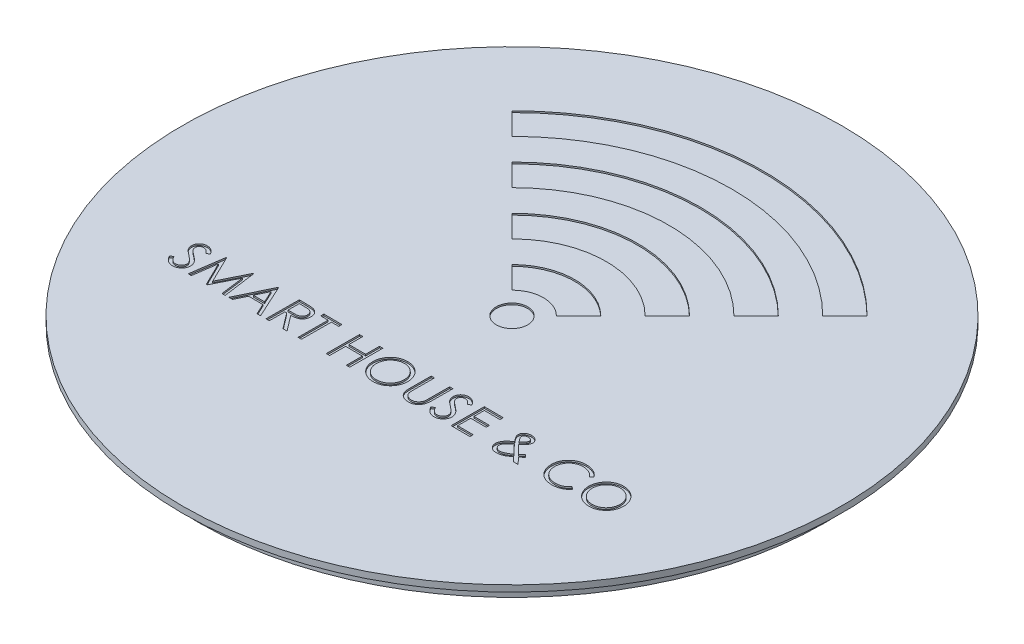
from build123d import *

# Parameters (mm, degrees)
CROQUIS1_R              = 105
SALIENTE_EXTRUIR1_DEPTH = 2
CROQUIS7_R              = 100
SALIENTE_EXTRUIR4_DEPTH = 5
CROQUIS8_R              = 5
CORTAR_EXTRUIR6_DEPTH   = 0.5


with BuildPart() as part:
    # Croquis1 → Saliente-Extruir1 (new body)
    with BuildSketch(Plane(origin=(0, 0, 0), x_dir=(1, 0, 0), z_dir=(0, 1, 0))):
        with Locations(Location((0, 0, 0), (0, 0, 270))):
            Circle(CROQUIS1_R)
    extrude(amount=SALIENTE_EXTRUIR1_DEPTH)

    # Croquis7 → Saliente-Extruir4 (add)
    with BuildSketch(Plane.XZ):
        with Locations(Location((0, 0, 0), (0, 0, 90))):
            Circle(CROQUIS7_R)
    extrude(amount=SALIENTE_EXTRUIR4_DEPTH)

    # Croquis8 → Cortar-Extruir6 (cut)
    # profile 1 of 18: a face of its own
    with BuildSketch(Plane(origin=(0, 2, 0), x_dir=(1, 0, 0), z_dir=(0, 1, 0))):
        with Locations(Location((0, 0, 0), (0, 0, 270))):
            Circle(CROQUIS8_R)
    # profile 2 of 18: a face of its own
    with BuildSketch(Plane(origin=(0, 2, 0), x_dir=(1, 0, 0), z_dir=(0, 1, 0))):
        with BuildLine():
            Line((7.071067812, 7.071067812), (14.142135624, 14.142135624))
            ThreePointArc((14.142135624, 14.142135624), (0, 20), (-14.142135624, 14.142135624))
            Line((-14.142135624, 14.142135624), (-7.071067812, 7.071067812))
            ThreePointArc((-7.071067812, 7.071067812), (0, 10), (7.071067812, 7.071067812))
        make_face()
    # profile 3 of 18: a face of its own
    with BuildSketch(Plane(origin=(0, 2, 0), x_dir=(1, 0, 0), z_dir=(0, 1, 0))):
        with BuildLine():
            Line((-21.213203436, 21.213203436), (-28.284271247, 28.284271247))
            ThreePointArc((-28.284271247, 28.284271247), (0, 40), (28.284271247, 28.284271247))
            Line((28.284271247, 28.284271247), (21.213203436, 21.213203436))
            ThreePointArc((21.213203436, 21.213203436), (0, 30), (-21.213203436, 21.213203436))
        make_face()
    # profile 4 of 18: a face of its own
    with BuildSketch(Plane(origin=(0, 2, 0), x_dir=(1, 0, 0), z_dir=(0, 1, 0))):
        with BuildLine():
            Line((-35.355339059, 35.355339059), (-42.426406871, 42.426406871))
            ThreePointArc((-42.426406871, 42.426406871), (0, 60), (42.426406871, 42.426406871))
            Line((42.426406871, 42.426406871), (35.355339059, 35.355339059))
            ThreePointArc((35.355339059, 35.355339059), (0, 50), (-35.355339059, 35.355339059))
        make_face()
    # profile 5 of 18: a face of its own
    with BuildSketch(Plane(origin=(0, 2, 0), x_dir=(1, 0, 0), z_dir=(0, 1, 0))):
        with BuildLine():
            Line((-49.497474683, 49.497474683), (-56.568542495, 56.568542495))
            ThreePointArc((-56.568542495, 56.568542495), (0, 80), (56.568542495, 56.568542495))
            Line((56.568542495, 56.568542495), (49.497474683, 49.497474683))
            ThreePointArc((49.497474683, 49.497474683), (0, 70), (-49.497474683, 49.497474683))
        make_face()
    # profile 6 of 18: a face of its own
    with BuildSketch(Plane(origin=(0, 2, 0), x_dir=(1, 0, 0), z_dir=(0, 1, 0))):
        with BuildLine():
            add(Edge.make_bspline(
                [(64.763555021, -29.24070179), (64.958889562, -29.246025488), (65.34268299, -29.256485494), (65.905343311, -29.338125575), (66.444213855, -29.463457398), (66.958018963, -29.643451971), (67.447673108, -29.87073064), (67.912854041, -30.147767488), (68.351658709, -30.477151302), (68.761360882, -30.851912606), (69.134268077, -31.261985091), (69.461159464, -31.699181452), (69.738572071, -32.158854637), (69.9646275, -32.641820202), (70.136754058, -33.148469147), (70.258964274, -33.676810359), (70.33656483, -34.228295648), (70.342601339, -34.604187365), (70.345669738, -34.795255743)],
                knots=[0, 0, 0, 0, 1.066480477, 2.095421517, 3.099031254, 4.08412256, 5.063237125, 6.042922112, 7.035658862, 8.054735947, 9.071214844, 10.058549417, 11.031612258, 11.998600907, 12.965319905, 13.948375013, 14.957144731, 16, 16, 16, 16], degree=3))
            add(Edge.make_bspline(
                [(70.345669738, -34.795255743), (70.340238254, -34.984220598), (70.329531059, -35.356730869), (70.248734215, -35.904256422), (70.120123795, -36.429129101), (69.940412356, -36.932143756), (69.710794761, -37.412280517), (69.430915544, -37.871089015), (69.100903269, -38.307381443), (68.723125169, -38.713977567), (68.313707327, -39.08826559), (67.875297272, -39.414111734), (67.41469944, -39.688974396), (66.933124801, -39.915899899), (66.428304047, -40.089979232), (65.901934629, -40.212734136), (65.354330055, -40.286399959), (64.982149415, -40.294710151), (64.793235844, -40.298928285)],
                knots=[0, 0, 0, 0, 1.041586142, 2.053299996, 3.044639854, 4.017045683, 4.993028163, 5.974022359, 6.975419105, 8.003943238, 9.030080649, 10.029922165, 11.010227414, 11.982875217, 12.960047006, 13.948649357, 14.958763746, 16, 16, 16, 16], degree=3))
            add(Edge.make_bspline(
                [(64.793235844, -40.298928285), (64.601443609, -40.293550789), (64.224703502, -40.2829877), (63.671543181, -40.202035232), (63.141860576, -40.073063417), (62.634703154, -39.894149134), (62.150297262, -39.666569559), (61.689928461, -39.386218182), (61.252359839, -39.056877126), (60.844118748, -38.680660533), (60.471242192, -38.271352388), (60.145239797, -37.835381231), (59.869960751, -37.378628701), (59.642887221, -36.90227941), (59.471306449, -36.402445291), (59.348873047, -35.882672801), (59.271272968, -35.342465094), (59.265119485, -34.975019327), (59.262002537, -34.788895566)],
                knots=[0, 0, 0, 0, 1.058465599, 2.079158432, 3.079305173, 4.06394649, 5.042991754, 6.028536918, 7.034290932, 8.06144979, 9.088860518, 10.086813485, 11.061644533, 12.028440788, 12.994488971, 13.97292776, 14.973219061, 16, 16, 16, 16], degree=3))
            add(Edge.make_bspline(
                [(59.262002537, -34.788895566), (59.264337582, -34.663704374), (59.26897902, -34.414858136), (59.309601285, -34.045429557), (59.368422259, -33.682979989), (59.448141929, -33.326782206), (59.555856993, -32.979203377), (59.682032042, -32.637160477), (59.833745847, -32.303209113), (60.006846489, -31.978385662), (60.199244888, -31.665316563), (60.408629624, -31.367812374), (60.637507384, -31.089347677), (60.879428872, -30.826360106), (61.141084236, -30.583825494), (61.415774897, -30.356040851), (61.709971785, -30.148353622), (62.017797482, -29.958229472), (62.338185736, -29.788832281), (62.665921055, -29.640599237), (63.000024425, -29.514706277), (63.340045264, -29.412787758), (63.687083879, -29.333859057), (64.040601043, -29.279307876), (64.400407104, -29.246780858), (64.641938344, -29.242737643), (64.763555021, -29.24070179)],
                knots=[0, 0, 0, 0, 1.036737542, 2.060753897, 3.075103556, 4.077695985, 5.081364496, 6.087164683, 7.095839733, 8.117175411, 9.13422416, 10.137978025, 11.12813741, 12.118141044, 13.095586573, 14.081219155, 15.07203589, 16.076045774, 17.076379801, 18.071975159, 19.053793285, 20.031659432, 21.010121144, 21.999501524, 22.992701819, 24, 24, 24, 24], degree=3))
        make_face()
        with BuildLine():
            add(Edge.make_bspline(
                [(64.810196314, -30.273170406), (64.713336953, -30.274871974), (64.520696728, -30.278256164), (64.233556725, -30.303269385), (63.951084524, -30.350645698), (63.672002743, -30.416500576), (63.396972425, -30.502012504), (63.124028201, -30.60287272), (62.856526227, -30.727528546), (62.593770765, -30.868122521), (62.339152858, -31.024687905), (62.098706052, -31.195806363), (61.871679878, -31.379448757), (61.659318357, -31.577207837), (61.460809788, -31.788109618), (61.276957359, -32.012893918), (61.107622524, -32.250076876), (60.952726876, -32.499833328), (60.816009121, -32.760419129), (60.693586565, -33.027950332), (60.592971728, -33.304238905), (60.506566961, -33.587575614), (60.441738296, -33.879011266), (60.395483769, -34.177910327), (60.364310723, -34.483662987), (60.360168247, -34.690589156), (60.358072917, -34.795255743)],
                knots=[0, 0, 0, 0, 0.988012236, 1.965023296, 2.93680795, 3.907228056, 4.887716744, 5.873174782, 6.873080972, 7.895445908, 8.911744251, 9.919854061, 10.903834491, 11.888263715, 12.877616234, 13.856009207, 14.848193998, 15.848437938, 16.851302053, 17.848215479, 18.847185769, 19.848364419, 20.867955437, 21.889557661, 22.932504293, 24, 24, 24, 24], degree=3))
            add(Edge.make_bspline(
                [(60.358072917, -34.795255743), (60.360531339, -34.948816458), (60.365365861, -35.250795852), (60.427427967, -35.694457643), (60.526040878, -36.120082559), (60.667241812, -36.527705641), (60.847695565, -36.917387207), (61.070469309, -37.288163829), (61.331794033, -37.642340889), (61.634617499, -37.970720611), (61.960765638, -38.275885624), (62.313304751, -38.538072956), (62.678611659, -38.766771581), (63.064836332, -38.947756891), (63.465280799, -39.093864974), (63.882954522, -39.197944578), (64.317910158, -39.259985788), (64.613538209, -39.269905921), (64.763555021, -39.274939904)],
                knots=[0, 0, 0, 0, 1.053017702, 2.070774718, 3.067059598, 4.047018636, 5.025500756, 6.00851463, 7.010401421, 8.040217454, 9.069736588, 10.070637084, 11.050392128, 12.02215799, 12.991634333, 13.971353373, 14.970560815, 16, 16, 16, 16], degree=3))
            add(Edge.make_bspline(
                [(64.763555021, -39.274939904), (64.864660891, -39.273307021), (65.065075635, -39.270070278), (65.363270893, -39.244239929), (65.655789969, -39.199916835), (65.942769129, -39.136450039), (66.223364039, -39.052547626), (66.499435183, -38.953722169), (66.769236406, -38.834469693), (67.031702097, -38.696580601), (67.284500938, -38.542911194), (67.52453507, -38.37508244), (67.751522552, -38.194209791), (67.961681872, -37.996973681), (68.160905393, -37.788866772), (68.342862338, -37.565672104), (68.51107081, -37.32893044), (68.665559019, -37.080091639), (68.802310395, -36.819503182), (68.924486235, -36.55190305), (69.025986313, -36.276082254), (69.108558548, -35.992552313), (69.174912396, -35.702438617), (69.220400588, -35.404783854), (69.251894332, -35.100503286), (69.256001824, -34.894979565), (69.258079594, -34.791015625)],
                knots=[0, 0, 0, 0, 1.027865415, 2.03746218, 3.040415186, 4.034059841, 5.023017468, 6.016246394, 7.013521287, 8.019455302, 9.028668486, 10.019321209, 10.995564338, 11.976765725, 12.947493611, 13.922678539, 14.901588535, 15.898552783, 16.898128616, 17.891773272, 18.887468046, 19.883318352, 20.892557113, 21.910809614, 22.943185431, 24, 24, 24, 24], degree=3))
            add(Edge.make_bspline(
                [(69.258079594, -34.791015625), (69.256420354, -34.687794567), (69.253130869, -34.483156143), (69.227794628, -34.179953538), (69.18275683, -33.884859916), (69.121638533, -33.597089135), (69.040865249, -33.31654157), (68.940880279, -33.043475099), (68.824589095, -32.777272431), (68.688205505, -32.520660655), (68.535881517, -32.274105658), (68.370829321, -32.036711299), (68.187506106, -31.815202219), (67.99229649, -31.603298382), (67.779655341, -31.406431432), (67.551604799, -31.221952485), (67.310770054, -31.047227272), (67.054437661, -30.890200901), (66.790721526, -30.745231481), (66.51963835, -30.621051944), (66.245185362, -30.514119236), (65.966189999, -30.426670999), (65.682729355, -30.359230408), (65.395242901, -30.310324), (65.104133207, -30.279660012), (64.908499547, -30.275340767), (64.810196314, -30.273170406)],
                knots=[0, 0, 0, 0, 1.053322565, 2.088239301, 3.102059752, 4.097867256, 5.088490546, 6.078641198, 7.063525053, 8.050703418, 9.041457957, 10.01985135, 10.998669923, 11.973335075, 12.958192526, 13.952745732, 14.965488279, 15.992155319, 17.018391661, 18.034850707, 19.032614895, 20.022555413, 21.01611451, 22.003740605, 22.996907018, 24, 24, 24, 24], degree=3))
        make_face(mode=Mode.SUBTRACT)
    # profile 7 of 18: a face of its own
    with BuildSketch(Plane(origin=(0, 2, 0), x_dir=(1, 0, 0), z_dir=(0, 1, 0))):
        with BuildLine():
            Line((57.599876469, -31.485844017), (56.764573317, -32.117621528))
            add(Edge.make_bspline(
                [(56.764573317, -32.117621528), (56.70766709, -32.043961168), (56.594761433, -31.897814223), (56.408538472, -31.695765102), (56.217808661, -31.502982354), (56.016649262, -31.325240406), (55.805760221, -31.161841158), (55.587726268, -31.010671759), (55.359852801, -30.874948443), (55.124505495, -30.752641276), (54.882986459, -30.640525959), (54.632408323, -30.549132464), (54.377197123, -30.468018474), (54.116566105, -30.398919833), (53.848391162, -30.349522332), (53.57547156, -30.310816369), (53.295873561, -30.286829445), (53.107518373, -30.283392377), (53.012069311, -30.281650641)],
                knots=[0, 0, 0, 0, 1.030072775, 2.043731383, 3.039569046, 4.031742415, 5.01302796, 5.991815002, 6.967313047, 7.947193968, 8.92754332, 9.912875421, 10.897710381, 11.892102416, 12.895655593, 13.914734875, 14.943291108, 16, 16, 16, 16], degree=3))
            add(Edge.make_bspline(
                [(53.012069311, -30.281650641), (52.908152379, -30.283388485), (52.701419985, -30.286845753), (52.394445038, -30.311224762), (52.094026112, -30.359887096), (51.798000685, -30.421807698), (51.508463758, -30.508250383), (51.222658986, -30.608630797), (50.945569813, -30.733336384), (50.674212166, -30.871803528), (50.415657831, -31.028985987), (50.167637775, -31.19586223), (49.936916038, -31.379072827), (49.719117402, -31.574153843), (49.518840495, -31.784626957), (49.330272715, -32.005670891), (49.159091748, -32.241597707), (49.002173699, -32.48920385), (48.862543605, -32.747041152), (48.741705362, -33.0137128), (48.636044745, -33.286877072), (48.555654395, -33.570814928), (48.485211115, -33.860826612), (48.440838364, -34.16104675), (48.409281561, -34.468100703), (48.405146206, -34.67574259), (48.403061565, -34.780415331)],
                knots=[0, 0, 0, 0, 1.04139569, 2.071753077, 3.082354545, 4.089376716, 5.100077429, 6.108070248, 7.122633903, 8.142497508, 9.159036466, 10.152925182, 11.136160435, 12.108909118, 13.080574533, 14.045351005, 15.018460509, 15.998835287, 16.981126483, 17.95402982, 18.931253536, 19.912778613, 20.909086413, 21.919687881, 22.951309988, 24, 24, 24, 24], degree=3))
            add(Edge.make_bspline(
                [(48.403061565, -34.780415331), (48.406426792, -34.93749611), (48.413045923, -35.246461383), (48.474247494, -35.700059049), (48.572962973, -36.135077265), (48.715251523, -36.55044891), (48.901493221, -36.944891687), (49.127591881, -37.319747357), (49.39353303, -37.675866771), (49.70044927, -38.00607613), (50.037119865, -38.308635643), (50.400875988, -38.571882542), (50.785681833, -38.796342315), (51.19188189, -38.982691904), (51.622210364, -39.12280914), (52.072209568, -39.228567969), (52.544705216, -39.289646618), (52.867029094, -39.299568637), (53.03114984, -39.304620726)],
                knots=[0, 0, 0, 0, 1.04114744, 2.047853384, 3.028841231, 3.995044826, 4.953031867, 5.915797611, 6.893298517, 7.894766775, 8.900337837, 9.89015014, 10.866650883, 11.85015373, 12.847436254, 13.862494403, 14.911625736, 16, 16, 16, 16], degree=3))
            add(Edge.make_bspline(
                [(53.03114984, -39.304620726), (53.211639969, -39.300881572), (53.567345608, -39.293512536), (54.089492905, -39.212938453), (54.589014276, -39.078565884), (55.067137926, -38.891902862), (55.521244457, -38.647217644), (55.953821353, -38.350884939), (56.364477468, -37.99919929), (56.611137338, -37.729331769), (56.737012553, -37.591613248)],
                knots=[0, 0, 0, 0, 1.025761438, 2.021546153, 2.99544534, 3.962646408, 4.933555875, 5.922308906, 6.939714775, 8, 8, 8, 8], degree=3))
            Line((56.737012553, -37.591613248), (57.56383547, -38.225510817))
            add(Edge.make_bspline(
                [(57.56383547, -38.225510817), (57.496892524, -38.306844998), (57.363223979, -38.469249287), (57.14737321, -38.698178086), (56.916816047, -38.909929172), (56.67685355, -39.110277277), (56.424571656, -39.297111613), (56.159003031, -39.469072802), (55.881187322, -39.625689618), (55.592298167, -39.767633855), (55.294353707, -39.895672833), (54.984820339, -40.002839747), (54.668379029, -40.097168602), (54.342136229, -40.169884699), (54.009356981, -40.231126672), (53.666431358, -40.269252588), (53.315697558, -40.297002731), (53.078555532, -40.298283134), (52.959067842, -40.298928285)],
                knots=[0, 0, 0, 0, 0.966184171, 1.929231373, 2.883422578, 3.83631357, 4.795797521, 5.761416048, 6.736799811, 7.719652295, 8.713052809, 9.709515828, 10.722916398, 11.740414375, 12.774281871, 13.825263903, 14.904225458, 16, 16, 16, 16], degree=3))
            add(Edge.make_bspline(
                [(52.959067842, -40.298928285), (52.84524955, -40.29720299), (52.620907973, -40.293802345), (52.289115348, -40.269734445), (51.966435346, -40.232057143), (51.65319155, -40.178642288), (51.348690433, -40.113374326), (51.053497411, -40.03281264), (50.767936982, -39.937057417), (50.490226635, -39.829625722), (50.223744186, -39.703328234), (49.965093096, -39.566089298), (49.715024529, -39.415205568), (49.476662161, -39.247478369), (49.245498387, -39.066084278), (49.025154879, -38.870188063), (48.812148998, -38.660580337), (48.679926909, -38.511112375), (48.612947382, -38.435396635)],
                knots=[0, 0, 0, 0, 1.117876981, 2.203391743, 3.265825228, 4.307674998, 5.323321263, 6.323551801, 7.311300932, 8.280610687, 9.246335005, 10.205852996, 11.155807992, 12.112837218, 13.066815803, 14.040415603, 15.007336543, 16, 16, 16, 16], degree=3))
            add(Edge.make_bspline(
                [(48.612947382, -38.435396635), (48.506409745, -38.304511846), (48.294860606, -38.044617174), (48.025792675, -37.621593262), (47.799043633, -37.179474745), (47.610332254, -36.719027698), (47.466092778, -36.237553247), (47.364990248, -35.735824508), (47.304461661, -35.214406376), (47.297701815, -34.860432926), (47.294270833, -34.680772569)],
                knots=[0, 0, 0, 0, 0.995083708, 1.975912988, 2.951231747, 3.923756722, 4.907833335, 5.912021988, 6.940240087, 8, 8, 8, 8], degree=3))
            add(Edge.make_bspline(
                [(47.294270833, -34.680772569), (47.299435234, -34.491769674), (47.3095996, -34.119781733), (47.393819965, -33.574744061), (47.521998738, -33.05157594), (47.703208426, -32.552331986), (47.932764951, -32.075036439), (48.218268209, -31.62462303), (48.549108758, -31.193977364), (48.930788813, -30.794570414), (49.345818941, -30.426990497), (49.794018366, -30.107590546), (50.266324177, -29.836118036), (50.765191463, -29.617886801), (51.288326519, -29.446603691), (51.836714616, -29.327465636), (52.410695764, -29.252298622), (52.801943186, -29.246022503), (53.001469017, -29.242821848)],
                knots=[0, 0, 0, 0, 1.030158166, 2.027516113, 3.000498436, 3.963539271, 4.918395332, 5.882846155, 6.866409552, 7.875020706, 8.890821121, 9.885345871, 10.870968157, 11.856228752, 12.849446023, 13.867677765, 14.912572087, 16, 16, 16, 16], degree=3))
            add(Edge.make_bspline(
                [(53.001469017, -29.242821848), (53.12307595, -29.244974107), (53.363118869, -29.249222504), (53.719208521, -29.279558538), (54.065504156, -29.329394232), (54.40410627, -29.39050167), (54.731648516, -29.477890535), (55.051764675, -29.577780732), (55.361876828, -29.700068748), (55.663004629, -29.83738499), (55.952834073, -29.991391635), (56.228460057, -30.162353841), (56.493268996, -30.343483984), (56.740337167, -30.544517387), (56.977809357, -30.756418943), (57.199049568, -30.985523434), (57.408772443, -31.227705667), (57.535940937, -31.399481562), (57.599876469, -31.485844017)],
                knots=[0, 0, 0, 0, 1.097419881, 2.16622412, 3.222395201, 4.254334303, 5.269082988, 6.279594037, 7.279178134, 8.275174951, 9.265212015, 10.238718646, 11.201131781, 12.158311203, 13.111146369, 14.071803988, 15.030575614, 16, 16, 16, 16], degree=3))
        make_face()
    # profile 8 of 18: a face of its own
    with BuildSketch(Plane(origin=(0, 2, 0), x_dir=(1, 0, 0), z_dir=(0, 1, 0))):
        with BuildLine():
            Line((40.541883681, -36.156333467), (41.252103365, -36.917434562))
            add(Edge.make_bspline(
                [(41.252103365, -36.917434562), (41.140053219, -37.015323624), (40.922649812, -37.205251227), (40.601505089, -37.475306803), (40.302026055, -37.729844071), (40.10347247, -37.886840127), (40.007628873, -37.962623531)],
                knots=[0, 0, 0, 0, 1.098479744, 2.1313068, 3.097965033, 4, 4, 4, 4], degree=3))
            add(Edge.make_bspline(
                [(40.007628873, -37.962623531), (40.074497787, -38.034253039), (40.220492357, -38.190641391), (40.464791826, -38.439753049), (40.742145255, -38.733972646), (40.944932453, -38.939010728), (41.052817842, -39.048093616)],
                knots=[0, 0, 0, 0, 0.780303742, 1.703633321, 2.77830349, 4, 4, 4, 4], degree=3))
            add(Edge.make_bspline(
                [(41.052817842, -39.048093616), (41.141062629, -39.136546449), (41.312655676, -39.308544042), (41.552510491, -39.568910762), (41.778923838, -39.812818008), (41.918324546, -39.976214415), (41.985643697, -40.055121528)],
                knots=[0, 0, 0, 0, 1.091843561, 2.123102899, 3.09361207, 4, 4, 4, 4], degree=3))
            Line((41.985643697, -40.055121528), (40.520683093, -40.048761351))
            Line((40.520683093, -40.048761351), (39.17444578, -38.630442041))
            add(Edge.make_bspline(
                [(39.17444578, -38.630442041), (39.063863725, -38.712918364), (38.85002153, -38.872410047), (38.534204416, -39.095361765), (38.234056542, -39.29438594), (37.953379267, -39.475378918), (37.688079336, -39.633497483), (37.438186328, -39.766135793), (37.206786538, -39.87981198), (36.921857036, -40.001992922), (36.567684788, -40.116178618), (36.13687548, -40.217418914), (35.69347181, -40.275144664), (35.394540134, -40.282500205), (35.243856838, -40.286207933)],
                knots=[0, 0, 0, 0, 1.140693549, 2.205858906, 3.19611503, 4.118473484, 4.967320685, 5.748983737, 6.457237516, 7.09870039, 8.310927132, 9.52855032, 10.754209696, 12, 12, 12, 12], degree=3))
            add(Edge.make_bspline(
                [(35.243856838, -40.286207933), (35.144819487, -40.283567503), (34.951105191, -40.278402897), (34.668858788, -40.243919491), (34.401091422, -40.189291346), (34.148976962, -40.111089978), (33.9114326, -40.010251651), (33.68845398, -39.890011641), (33.480522199, -39.746767736), (33.291812231, -39.58150963), (33.119309582, -39.402359988), (32.971514804, -39.208786466), (32.84380354, -39.00594459), (32.743596175, -38.790777153), (32.660107953, -38.566811598), (32.607593575, -38.330577743), (32.571208653, -38.084600237), (32.567907804, -37.916831051), (32.566222623, -37.831179888)],
                knots=[0, 0, 0, 0, 1.166436736, 2.281517716, 3.344293869, 4.38163215, 5.385016872, 6.379523137, 7.360843545, 8.352209587, 9.329567906, 10.285239896, 11.216120302, 12.146963491, 13.076465835, 14.025444037, 14.991930402, 16, 16, 16, 16], degree=3))
            add(Edge.make_bspline(
                [(32.566222623, -37.831179888), (32.573258167, -37.699165158), (32.587468974, -37.432514012), (32.689257861, -37.035007082), (32.847471244, -36.63901973), (33.029903704, -36.311289335), (33.216225137, -36.044904697), (33.391916563, -35.828169979), (33.599124304, -35.598773953), (33.83878101, -35.356098127), (34.109172282, -35.099525406), (34.416361981, -34.834509024), (34.750611715, -34.550542569), (34.988819986, -34.362701488), (35.112413194, -34.265241052)],
                knots=[0, 0, 0, 0, 1.046820167, 2.114429185, 3.236909509, 4.424213621, 5.080657719, 5.814514911, 6.63642802, 7.532553187, 8.520228328, 9.593154786, 10.751220008, 12, 12, 12, 12], degree=3))
            add(Edge.make_bspline(
                [(35.112413194, -34.265241052), (35.043476884, -34.181455444), (34.910583606, -34.019936151), (34.725622722, -33.782602152), (34.556692168, -33.565108454), (34.410701262, -33.36236851), (34.281023261, -33.178636575), (34.169831873, -33.01201778), (34.080997476, -32.860349113), (33.985409935, -32.68667534), (33.897734233, -32.479572664), (33.82026621, -32.238583025), (33.773071088, -32.002150116), (33.767026509, -31.846451818), (33.764055823, -31.769931891)],
                knots=[0, 0, 0, 0, 1.350487771, 2.603428373, 3.745283003, 4.778115756, 5.712784749, 6.54474205, 7.270388257, 7.90012321, 9.011273691, 10.062890135, 11.04798249, 12, 12, 12, 12], degree=3))
            add(Edge.make_bspline(
                [(33.764055823, -31.769931891), (33.766117931, -31.705496433), (33.770151526, -31.579457238), (33.801181747, -31.394686548), (33.849437098, -31.218150965), (33.917754152, -31.050610228), (34.003506343, -30.890686986), (34.109814634, -30.741396374), (34.234215166, -30.598531331), (34.329800469, -30.513823762), (34.378872863, -30.470335871)],
                knots=[0, 0, 0, 0, 1.039857389, 2.03401655, 3.016717178, 3.989230655, 4.949010733, 5.939825086, 6.942329906, 8, 8, 8, 8], degree=3))
            add(Edge.make_bspline(
                [(34.378872863, -30.470335871), (34.438737076, -30.422438891), (34.557897376, -30.327099486), (34.752000944, -30.207020762), (34.955544932, -30.104187908), (35.169301561, -30.018483235), (35.395843096, -29.956344389), (35.630788164, -29.908468241), (35.877216891, -29.883704543), (36.044484689, -29.880485832), (36.1300414, -29.878839476)],
                knots=[0, 0, 0, 0, 0.973492464, 1.937746257, 2.893558284, 3.869078126, 4.858347323, 5.874517614, 6.912825528, 8, 8, 8, 8], degree=3))
            add(Edge.make_bspline(
                [(36.1300414, -29.878839476), (36.237670541, -29.881960209), (36.449225281, -29.88809429), (36.758725877, -29.940628553), (37.053677633, -30.025005773), (37.329323277, -30.144310364), (37.584018831, -30.286438982), (37.808801997, -30.455213004), (38.002624401, -30.646692774), (38.157593201, -30.862395704), (38.284613942, -31.087678321), (38.371495925, -31.324824618), (38.427419162, -31.567320841), (38.4335871, -31.732177945), (38.436665331, -31.814453125)],
                knots=[0, 0, 0, 0, 1.156239637, 2.272692802, 3.36413441, 4.446364256, 5.494106609, 6.49226497, 7.459119393, 8.410238837, 9.338421569, 10.230173272, 11.116733159, 12, 12, 12, 12], degree=3))
            add(Edge.make_bspline(
                [(38.436665331, -31.814453125), (38.432112425, -31.904669016), (38.422725712, -32.090666826), (38.344461977, -32.369943439), (38.226285474, -32.657624139), (38.089184731, -32.89988062), (37.951261846, -33.101482668), (37.822016286, -33.265503677), (37.672345071, -33.440438255), (37.499436258, -33.625427007), (37.303926846, -33.820194943), (37.08603385, -34.025851904), (36.842987919, -34.239197516), (36.673615405, -34.384827446), (36.585854033, -34.460286458)],
                knots=[0, 0, 0, 0, 0.975000956, 2.010156308, 3.118033065, 4.337129212, 5.013884262, 5.760508394, 6.595916299, 7.505095392, 8.50022852, 9.582381604, 10.747296692, 12, 12, 12, 12], degree=3))
            Line((36.585854033, -34.460286458), (38.171657986, -36.143613114))
            Line((38.171657986, -36.143613114), (39.261368189, -37.243923611))
            add(Edge.make_bspline(
                [(39.261368189, -37.243923611), (39.386567649, -37.13947182), (39.625365699, -36.940246646), (39.963596643, -36.654421311), (40.266475264, -36.397769925), (40.453749669, -36.233596042), (40.541883681, -36.156333467)],
                knots=[0, 0, 0, 0, 1.164564722, 2.221221933, 3.162881619, 4, 4, 4, 4], degree=3))
        make_face()
        with BuildLine():
            add(Edge.make_bspline(
                [(35.939236111, -33.669504541), (36.061005484, -33.573881972), (36.294903673, -33.390207333), (36.605519019, -33.095594884), (36.875581038, -32.809064062), (37.023716185, -32.606739384), (37.094668136, -32.509832399)],
                knots=[0, 0, 0, 0, 1.129959595, 2.17045959, 3.123709246, 4, 4, 4, 4], degree=3))
            add(Edge.make_bspline(
                [(37.094668136, -32.509832399), (37.136880107, -32.445151349), (37.216500129, -32.323150257), (37.300100024, -32.134578312), (37.359792346, -31.959392283), (37.366902042, -31.843843345), (37.370275775, -31.78901242)],
                knots=[0, 0, 0, 0, 1.182791557, 2.230975851, 3.160552824, 4, 4, 4, 4], degree=3))
            add(Edge.make_bspline(
                [(37.370275775, -31.78901242), (37.36636757, -31.729749121), (37.358535534, -31.61098557), (37.288543216, -31.441015113), (37.17289244, -31.287321004), (37.018280964, -31.148933325), (36.826862605, -31.032320124), (36.603433951, -30.948000301), (36.350748101, -30.896272047), (36.172709051, -30.890841094), (36.079159989, -30.887987447)],
                knots=[0, 0, 0, 0, 0.813099992, 1.629451003, 2.485398542, 3.442562307, 4.468418409, 5.552163863, 6.713805913, 8, 8, 8, 8], degree=3))
            add(Edge.make_bspline(
                [(36.079159989, -30.887987447), (35.990605885, -30.890360616), (35.819792027, -30.894938272), (35.575672984, -30.943225228), (35.35725996, -31.028859071), (35.169409072, -31.147603863), (35.014074058, -31.28740807), (34.900435397, -31.444635086), (34.829258258, -31.616584962), (34.820187688, -31.736771079), (34.815604968, -31.797492655)],
                knots=[0, 0, 0, 0, 1.230979963, 2.37446293, 3.442583965, 4.47648678, 5.45074163, 6.331993286, 7.157273744, 8, 8, 8, 8], degree=3))
            add(Edge.make_bspline(
                [(34.815604968, -31.797492655), (34.817278069, -31.844241274), (34.820623696, -31.937722472), (34.84631615, -32.075559926), (34.890836014, -32.209373297), (34.935196969, -32.292032237), (34.957648905, -32.333867521)],
                knots=[0, 0, 0, 0, 0.998953552, 1.997564312, 2.986528651, 4, 4, 4, 4], degree=3))
            add(Edge.make_bspline(
                [(34.957648905, -32.333867521), (35.020020708, -32.438534091), (35.150250284, -32.657073273), (35.379434809, -32.983331509), (35.644668096, -33.323930031), (35.838677924, -33.551534006), (35.939236111, -33.669504541)],
                knots=[0, 0, 0, 0, 0.880477546, 1.838398293, 2.879609603, 4, 4, 4, 4], degree=3))
        make_face(mode=Mode.SUBTRACT)
        with BuildLine():
            add(Edge.make_bspline(
                [(35.801432292, -35.064503205), (35.694444012, -35.145407876), (35.48833077, -35.301270967), (35.195042545, -35.532304576), (34.931272687, -35.751359399), (34.696627717, -35.957903997), (34.490761576, -36.150789771), (34.311225873, -36.330012157), (34.163112128, -36.499068653), (34.007181305, -36.701122276), (33.858021086, -36.942524036), (33.722166071, -37.224050859), (33.638669232, -37.497873749), (33.625976561, -37.67874857), (33.619891827, -37.765458066)],
                knots=[0, 0, 0, 0, 1.347640653, 2.596233766, 3.750763225, 4.792063998, 5.736407502, 6.584894889, 7.339648679, 7.992898896, 9.147406523, 10.182857177, 11.128880748, 12, 12, 12, 12], degree=3))
            add(Edge.make_bspline(
                [(33.619891827, -37.765458066), (33.620733396, -37.815032122), (33.622402358, -37.913345112), (33.64740433, -38.05819533), (33.684894505, -38.199372851), (33.740826231, -38.335897201), (33.812976784, -38.467273358), (33.901825925, -38.593244772), (34.003401951, -38.717057947), (34.12101465, -38.833617698), (34.249178604, -38.942092205), (34.38807963, -39.034717139), (34.532538729, -39.116785969), (34.685638801, -39.182004059), (34.84529897, -39.233410128), (35.012314713, -39.268750245), (35.185904394, -39.293235661), (35.304545586, -39.296569961), (35.364700187, -39.29826055)],
                knots=[0, 0, 0, 0, 0.92328397, 1.831014385, 2.73250603, 3.642815366, 4.574617673, 5.521394849, 6.513490852, 7.557109436, 8.604879594, 9.639222128, 10.665728301, 11.698726877, 12.736421688, 13.788409573, 14.878658093, 16, 16, 16, 16], degree=3))
            add(Edge.make_bspline(
                [(35.364700187, -39.29826055), (35.457450593, -39.296155832), (35.64322875, -39.291940101), (35.919341308, -39.24696725), (36.193703168, -39.177656924), (36.370904768, -39.109977327), (36.460770566, -39.07565438)],
                knots=[0, 0, 0, 0, 0.988099378, 1.979153407, 2.97515038, 4, 4, 4, 4], degree=3))
            add(Edge.make_bspline(
                [(36.460770566, -39.07565438), (36.533008988, -39.043496619), (36.68205256, -38.977148164), (36.909467963, -38.867627442), (37.1439891, -38.738695424), (37.389625032, -38.599423306), (37.645529541, -38.446439496), (37.908841142, -38.276537672), (38.183513548, -38.094119388), (38.367684355, -37.965145034), (38.462106036, -37.899021768)],
                knots=[0, 0, 0, 0, 0.815991737, 1.683568377, 2.603739856, 3.577024653, 4.597574676, 5.679859466, 6.810497859, 8, 8, 8, 8], degree=3))
            Line((38.462106036, -37.899021768), (36.755458734, -36.128772703))
            add(Edge.make_bspline(
                [(36.755458734, -36.128772703), (36.682619722, -36.049670967), (36.531500995, -35.885558998), (36.298304218, -35.630274998), (36.054726627, -35.353185433), (35.887631792, -35.162745685), (35.801432292, -35.064503205)],
                knots=[0, 0, 0, 0, 0.902766225, 1.872964478, 2.902722525, 4, 4, 4, 4], degree=3))
        make_face(mode=Mode.SUBTRACT)
    # profile 9 of 18: a face of its own
    with BuildSketch(Plane(origin=(0, 2, 0), x_dir=(1, 0, 0), z_dir=(0, 1, 0))):
        Polygon((20.679053152, -29.480268429), (26.710620326, -29.512069311), (26.70426015, -30.550898104), (21.724242121, -30.525457399), (21.707281651, -33.815788595), (26.642778446, -33.8412293), (26.638538328, -34.871577858), (21.703041533, -34.846137153), (21.681840946, -38.976011619), (26.61733774, -39.001452324), (26.610977564, -40.038161058), (20.623931624, -40.006360176), align=None)
    # profile 10 of 18: a face of its own
    with BuildSketch(Plane(origin=(0, 2, 0), x_dir=(1, 0, 0), z_dir=(0, 1, 0))):
        with BuildLine():
            Line((12.211538462, -38.038945646), (13.108323317, -37.508930956))
            add(Edge.make_bspline(
                [(13.108323317, -37.508930956), (13.185876641, -37.646730921), (13.334138046, -37.910167938), (13.583040392, -38.265915967), (13.839862627, -38.568855764), (14.108131661, -38.817765075), (14.385955748, -39.013978014), (14.675477472, -39.152346998), (14.974600209, -39.239725932), (15.179049022, -39.251890565), (15.281383547, -39.257979434)],
                knots=[0, 0, 0, 0, 1.294935743, 2.475574008, 3.551377703, 4.543021948, 5.466572519, 6.326395502, 7.162296325, 8, 8, 8, 8], degree=3))
            add(Edge.make_bspline(
                [(15.281383547, -39.257979434), (15.368473108, -39.255085723), (15.541679969, -39.249330608), (15.797111671, -39.204400521), (16.043362491, -39.126042702), (16.279456776, -39.022271249), (16.495861626, -38.888181774), (16.692290251, -38.736584619), (16.856124333, -38.55807256), (16.99211236, -38.3621615), (17.100298501, -38.15340661), (17.177139006, -37.934258746), (17.225380998, -37.708886181), (17.232511743, -37.555804187), (17.236077724, -37.479250134)],
                knots=[0, 0, 0, 0, 1.066403098, 2.120900967, 3.163968401, 4.225653657, 5.270766288, 6.2751908, 7.255186697, 8.225269808, 9.18923197, 10.12551479, 11.062597511, 12, 12, 12, 12], degree=3))
            add(Edge.make_bspline(
                [(17.236077724, -37.479250134), (17.231902757, -37.391252065), (17.223478885, -37.21369752), (17.156622969, -36.949219765), (17.045390599, -36.687525325), (16.940419581, -36.524514152), (16.886268029, -36.440421341)],
                knots=[0, 0, 0, 0, 0.947931559, 1.912650568, 2.923196015, 4, 4, 4, 4], degree=3))
            add(Edge.make_bspline(
                [(16.886268029, -36.440421341), (16.841722694, -36.379819823), (16.747860888, -36.252125917), (16.586426728, -36.063034274), (16.400343218, -35.864286965), (16.187648716, -35.657653373), (15.951396748, -35.439120582), (15.686499835, -35.215080423), (15.399052054, -34.979228509), (15.195622171, -34.822950596), (15.090578259, -34.742254274)],
                knots=[0, 0, 0, 0, 0.727629123, 1.533192703, 2.404088764, 3.361591502, 4.402161533, 5.517756215, 6.71825813, 8, 8, 8, 8], degree=3))
            add(Edge.make_bspline(
                [(15.090578259, -34.742254274), (14.986512782, -34.661929333), (14.787304943, -34.508166928), (14.505160669, -34.284439445), (14.255589108, -34.075746558), (14.033394299, -33.888336761), (13.845312142, -33.714906454), (13.68846678, -33.55937008), (13.557811032, -33.425464532), (13.489204835, -33.335155293), (13.458133013, -33.29425414)],
                knots=[0, 0, 0, 0, 1.442492415, 2.761298054, 3.950721835, 5.012158634, 5.950560363, 6.756600183, 7.436862856, 8, 8, 8, 8], degree=3))
            add(Edge.make_bspline(
                [(13.458133013, -33.29425414), (13.413996609, -33.232025782), (13.326782861, -33.109062245), (13.215510813, -32.915470861), (13.118086835, -32.720239791), (13.042878151, -32.519211309), (12.97981871, -32.315882767), (12.937745858, -32.107784996), (12.914466131, -31.896263093), (12.910856054, -31.754440279), (12.909037794, -31.683009482)],
                knots=[0, 0, 0, 0, 1.056175749, 2.087008403, 3.089520072, 4.074823479, 5.056473362, 6.0355332, 7.010572241, 8, 8, 8, 8], degree=3))
            add(Edge.make_bspline(
                [(12.909037794, -31.683009482), (12.913807341, -31.57103143), (12.923212995, -31.3502082), (12.989313686, -31.027422299), (13.092382386, -30.719202697), (13.24057379, -30.430915428), (13.421913834, -30.163072105), (13.639845874, -29.923253773), (13.893139341, -29.716684791), (14.174916852, -29.541546216), (14.478679483, -29.399852988), (14.799615001, -29.296799696), (15.134213697, -29.236325458), (15.361703723, -29.229369386), (15.476428953, -29.225861378)],
                knots=[0, 0, 0, 0, 1.017145998, 2.005834713, 2.982688951, 3.962073139, 4.941773112, 5.914629338, 6.895612453, 7.90242707, 8.922407477, 9.933840439, 10.958017484, 12, 12, 12, 12], degree=3))
            add(Edge.make_bspline(
                [(15.476428953, -29.225861378), (15.598997472, -29.231185128), (15.841882373, -29.241734805), (16.199752404, -29.313147781), (16.54323677, -29.43373163), (16.818620086, -29.570922557), (17.035959103, -29.704994524), (17.199788903, -29.828638263), (17.36696285, -29.970053027), (17.535693584, -30.131164673), (17.707308373, -30.311823691), (17.881736691, -30.511653223), (18.056559473, -30.731914535), (18.171469858, -30.886944555), (18.230385283, -30.966429621)],
                knots=[0, 0, 0, 0, 1.2983051, 2.572754479, 3.848939882, 5.144673714, 5.823982832, 6.551692807, 7.316652647, 8.142768023, 9.021805767, 9.9556903, 10.951866935, 12, 12, 12, 12], degree=3))
            Line((18.230385283, -30.966429621), (17.369641426, -31.613047543))
            add(Edge.make_bspline(
                [(17.369641426, -31.613047543), (17.322021835, -31.549813814), (17.229979848, -31.42759189), (17.089893355, -31.256417337), (16.955796596, -31.100712546), (16.828176569, -30.961004945), (16.703640475, -30.840163495), (16.588647168, -30.732582177), (16.474844237, -30.645350419), (16.332500538, -30.549946695), (16.15216798, -30.455462269), (15.926983072, -30.373857614), (15.692063899, -30.323466704), (15.531794985, -30.316808536), (15.450988248, -30.313451522)],
                knots=[0, 0, 0, 0, 1.179900029, 2.280581192, 3.296372868, 4.24312201, 5.099783295, 5.882809001, 6.588692532, 7.234392071, 8.435960551, 9.612281121, 10.796124802, 12, 12, 12, 12], degree=3))
            add(Edge.make_bspline(
                [(15.450988248, -30.313451522), (15.34872811, -30.317318737), (15.15132182, -30.324784135), (14.870836867, -30.399547993), (14.617674781, -30.519280413), (14.401863904, -30.690037937), (14.222045118, -30.891330214), (14.094608841, -31.1235772), (14.01171004, -31.377107085), (14.003124236, -31.555858002), (13.998747997, -31.646968483)],
                knots=[0, 0, 0, 0, 1.111857927, 2.146366631, 3.138049351, 4.142116519, 5.124189684, 6.058159887, 7.010231728, 8, 8, 8, 8], degree=3))
            add(Edge.make_bspline(
                [(13.998747997, -31.646968483), (14.000363307, -31.70360092), (14.003590021, -31.816728813), (14.030240844, -31.985033252), (14.072357471, -32.15154791), (14.134573848, -32.317004652), (14.221770455, -32.48491323), (14.340843738, -32.655163548), (14.484470993, -32.836534012), (14.596931206, -32.953176125), (14.655966213, -33.014406384)],
                knots=[0, 0, 0, 0, 0.869914582, 1.737725049, 2.612237377, 3.505828338, 4.448180176, 5.511498126, 6.693682686, 8, 8, 8, 8], degree=3))
            add(Edge.make_bspline(
                [(14.655966213, -33.014406384), (14.677606645, -33.035203301), (14.72966388, -33.085231413), (14.828577811, -33.16334365), (14.953361773, -33.266283517), (15.10787469, -33.388928003), (15.29290817, -33.530002535), (15.505187458, -33.694739445), (15.748167111, -33.877719067), (15.920200023, -34.006631828), (16.010683761, -34.074435764)],
                knots=[0, 0, 0, 0, 0.418416212, 1.006522888, 1.756214741, 2.675215669, 3.757568232, 5.001582514, 6.422929556, 8, 8, 8, 8], degree=3))
            add(Edge.make_bspline(
                [(16.010683761, -34.074435764), (16.119999444, -34.157200654), (16.332272955, -34.317916786), (16.632454941, -34.561481684), (16.907095055, -34.796479347), (17.153610765, -35.025277493), (17.372625915, -35.2484005), (17.565680778, -35.463688618), (17.732508606, -35.67220622), (17.916380406, -35.936158222), (18.098782537, -36.264522301), (18.259073519, -36.662768501), (18.35775507, -37.063142703), (18.36899645, -37.331734986), (18.374549279, -37.464409722)],
                knots=[0, 0, 0, 0, 1.150314194, 2.233725536, 3.242759874, 4.182486407, 5.054573952, 5.865046338, 6.607681421, 7.293542182, 8.56222565, 9.749120323, 10.888147998, 12, 12, 12, 12], degree=3))
            add(Edge.make_bspline(
                [(18.374549279, -37.464409722), (18.371634137, -37.558561138), (18.36588333, -37.744297114), (18.322019811, -38.017925569), (18.251766205, -38.281194395), (18.156357937, -38.536442981), (18.030116542, -38.780047057), (17.878086793, -39.014352578), (17.70193413, -39.241103004), (17.496758593, -39.451941595), (17.275427107, -39.64795972), (17.038062776, -39.818822747), (16.789901389, -39.963767572), (16.529438596, -40.080563095), (16.258331665, -40.172508436), (15.975152757, -40.23831542), (15.679654654, -40.277421396), (15.478667721, -40.280438451), (15.376786191, -40.281967815)],
                knots=[0, 0, 0, 0, 0.988837301, 1.950715875, 2.903409772, 3.847997466, 4.807638377, 5.779692827, 6.779258937, 7.818966761, 8.865939354, 9.881806786, 10.886543479, 11.880135702, 12.875640147, 13.889579394, 14.930214642, 16, 16, 16, 16], degree=3))
            add(Edge.make_bspline(
                [(15.376786191, -40.281967815), (15.29755688, -40.280442149), (15.140804029, -40.277423663), (14.908631562, -40.250158826), (14.682237618, -40.21137945), (14.461868939, -40.153265378), (14.247648924, -40.078351235), (14.038178689, -39.990191976), (13.834919685, -39.885030584), (13.636858411, -39.763734213), (13.443118654, -39.623798181), (13.255371693, -39.460458577), (13.072112538, -39.276159745), (12.89072784, -39.07102412), (12.71294214, -38.845053368), (12.542015583, -38.595003316), (12.37145036, -38.326416833), (12.265707365, -38.13632426), (12.211538462, -38.038945646)],
                knots=[0, 0, 0, 0, 0.927495349, 1.835022158, 2.734399349, 3.615620976, 4.500255798, 5.39025525, 6.274890072, 7.177611815, 8.107945859, 9.070234294, 10.08847668, 11.149637082, 12.275437655, 13.453123444, 14.695313013, 16, 16, 16, 16], degree=3))
        make_face()
    # profile 11 of 18: a face of its own
    with BuildSketch(Plane(origin=(0, 2, 0), x_dir=(1, 0, 0), z_dir=(0, 1, 0))):
        with BuildLine():
            Line((3.74614383, -29.480268429), (4.797692975, -29.486628606))
            Line((4.797692975, -29.486628606), (4.763772035, -35.840444712))
            add(Edge.make_bspline(
                [(4.763772035, -35.840444712), (4.763815622, -35.930194003), (4.763898676, -36.101212337), (4.76334183, -36.344314123), (4.765112367, -36.56058502), (4.770130791, -36.749946482), (4.773362964, -36.912552917), (4.779879818, -37.048955485), (4.787110494, -37.158707003), (4.795994347, -37.22275362), (4.799813034, -37.250283787)],
                knots=[0, 0, 0, 0, 1.526450471, 2.908669402, 4.134696414, 5.204683736, 6.130481592, 6.900561118, 7.527410856, 8, 8, 8, 8], degree=3))
            add(Edge.make_bspline(
                [(4.799813034, -37.250283787), (4.814327175, -37.350438876), (4.842459752, -37.544568223), (4.923761433, -37.819473866), (5.023012771, -38.071904787), (5.155047632, -38.29923545), (5.31949065, -38.504817082), (5.521973573, -38.690849962), (5.763630339, -38.857189514), (6.036002676, -39.005008823), (6.327381184, -39.129078148), (6.627734523, -39.217467072), (6.928206835, -39.276163122), (7.129495189, -39.283846684), (7.229400374, -39.287660256)],
                knots=[0, 0, 0, 0, 1.043044638, 2.021720279, 2.950717515, 3.836279647, 4.723491737, 5.657541554, 6.663020499, 7.743235319, 8.851157437, 9.924061074, 10.969651963, 12, 12, 12, 12], degree=3))
            add(Edge.make_bspline(
                [(7.229400374, -39.287660256), (7.315772067, -39.285376918), (7.488053996, -39.280822441), (7.743317887, -39.239016652), (7.992851602, -39.171111574), (8.234371486, -39.07538504), (8.463968012, -38.955453015), (8.677328428, -38.813479856), (8.869480541, -38.64838511), (9.042397153, -38.463412831), (9.194022362, -38.255185937), (9.324477682, -38.02692651), (9.435078624, -37.777788255), (9.487787006, -37.601485393), (9.514823718, -37.511051015)],
                knots=[0, 0, 0, 0, 0.995025504, 1.984734894, 2.9728338, 3.971221504, 4.973225065, 5.953773401, 6.91863086, 7.886955274, 8.866183051, 9.880626161, 10.912869299, 12, 12, 12, 12], degree=3))
            add(Edge.make_bspline(
                [(9.514823718, -37.511051015), (9.523730833, -37.473684889), (9.543605226, -37.39031007), (9.565844786, -37.250773763), (9.584756196, -37.084543356), (9.598507796, -36.892100045), (9.611239182, -36.673011458), (9.622024943, -36.427788092), (9.628210904, -36.155658679), (9.628930008, -35.965531388), (9.629306891, -35.865885417)],
                knots=[0, 0, 0, 0, 0.557807062, 1.244631647, 2.050601553, 2.987461745, 4.046532847, 5.238360175, 6.552620824, 8, 8, 8, 8], degree=3))
            Line((9.629306891, -35.865885417), (9.663227831, -29.512069311))
            Line((9.663227831, -29.512069311), (10.714776976, -29.516309428))
            Line((10.714776976, -29.516309428), (10.680856036, -35.870125534))
            add(Edge.make_bspline(
                [(10.680856036, -35.870125534), (10.679446633, -35.984630219), (10.676687583, -36.208784723), (10.660715945, -36.535997431), (10.64137129, -36.846620526), (10.60865324, -37.139948575), (10.569359578, -37.416608198), (10.520222512, -37.676854167), (10.463864594, -37.919750256), (10.397678174, -38.148023918), (10.31938777, -38.364114345), (10.22345472, -38.571541161), (10.108317422, -38.769752227), (9.978678607, -38.962889116), (9.829142015, -39.146125507), (9.665613353, -39.325964452), (9.483131076, -39.497099124), (9.28466694, -39.658993784), (9.074538826, -39.811002485), (8.848732021, -39.938778354), (8.614444695, -40.051236863), (8.368383609, -40.139365083), (8.111568896, -40.207731802), (7.844237972, -40.255649114), (7.565818546, -40.286832437), (7.376477117, -40.289229975), (7.280281784, -40.29044805)],
                knots=[0, 0, 0, 0, 1.298654282, 2.542247116, 3.715180269, 4.827766475, 5.888718927, 6.883775268, 7.830564788, 8.715742754, 9.577868792, 10.434912906, 11.303793253, 12.175220614, 13.070214142, 13.983538541, 14.930429832, 15.904344279, 16.887319202, 17.867545454, 18.842745293, 19.831552012, 20.826963368, 21.853541952, 22.909487235, 24, 24, 24, 24], degree=3))
            add(Edge.make_bspline(
                [(7.280281784, -40.29044805), (7.17631918, -40.288350932), (6.971501531, -40.284219381), (6.669867771, -40.253365082), (6.37880764, -40.206505801), (6.100847076, -40.133890615), (5.832150808, -40.051643396), (5.576899189, -39.943898976), (5.332245455, -39.818737729), (5.100332145, -39.67556086), (4.884115877, -39.515925196), (4.683911965, -39.345400773), (4.505311612, -39.158724645), (4.343460744, -38.962745535), (4.203675744, -38.752772177), (4.078864223, -38.533435722), (3.9749165, -38.30033273), (3.921435943, -38.137681165), (3.894547943, -38.055906116)],
                knots=[0, 0, 0, 0, 1.145288089, 2.25634222, 3.338031392, 4.389939411, 5.419299557, 6.431553981, 7.437981655, 8.444951374, 9.430775735, 10.396969846, 11.338630163, 12.273829612, 13.193832182, 14.114263021, 15.051922844, 16, 16, 16, 16], degree=3))
            add(Edge.make_bspline(
                [(3.894547943, -38.055906116), (3.87887655, -37.999566531), (3.84488495, -37.877364717), (3.8089677, -37.675768557), (3.776959015, -37.443819489), (3.753210078, -37.181261863), (3.730498212, -36.888072655), (3.720267005, -36.564141556), (3.709921286, -36.209397592), (3.711434087, -35.962711306), (3.71222289, -35.834084535)],
                knots=[0, 0, 0, 0, 0.627464272, 1.36098398, 2.195682304, 3.140776433, 4.190428945, 5.352022852, 6.619295963, 8, 8, 8, 8], degree=3))
            Line((3.71222289, -35.834084535), (3.74614383, -29.480268429))
        make_face()
    # profile 12 of 18: a face of its own
    with BuildSketch(Plane(origin=(0, 2, 0), x_dir=(1, 0, 0), z_dir=(0, 1, 0))):
        with BuildLine():
            add(Edge.make_bspline(
                [(-4.028111645, -29.24070179), (-3.832777105, -29.246025488), (-3.448983676, -29.256485494), (-2.886323355, -29.338125575), (-2.347452811, -29.463457398), (-1.833647704, -29.643451971), (-1.343993558, -29.87073064), (-0.878812625, -30.147767488), (-0.440007958, -30.477151302), (-0.030305785, -30.851912606), (0.342601411, -31.261985091), (0.669492798, -31.699181452), (0.946905404, -32.158854637), (1.172960833, -32.641820202), (1.345087391, -33.148469147), (1.467297607, -33.676810359), (1.544898163, -34.228295648), (1.550934672, -34.604187365), (1.554003072, -34.795255743)],
                knots=[0, 0, 0, 0, 1.066480477, 2.095421517, 3.099031254, 4.08412256, 5.063237125, 6.042922112, 7.035658862, 8.054735947, 9.071214844, 10.058549417, 11.031612258, 11.998600907, 12.965319905, 13.948375013, 14.957144731, 16, 16, 16, 16], degree=3))
            add(Edge.make_bspline(
                [(1.554003072, -34.795255743), (1.548571588, -34.984220598), (1.537864392, -35.356730869), (1.457067549, -35.904256422), (1.328457128, -36.429129101), (1.14874569, -36.932143756), (0.919128094, -37.412280517), (0.639248877, -37.871089015), (0.309236602, -38.307381443), (-0.068541498, -38.713977567), (-0.47795934, -39.08826559), (-0.916369395, -39.414111734), (-1.376967227, -39.688974396), (-1.858541866, -39.915899899), (-2.36336262, -40.089979232), (-2.889732037, -40.212734136), (-3.437336611, -40.286399959), (-3.809517252, -40.294710151), (-3.998430823, -40.298928285)],
                knots=[0, 0, 0, 0, 1.041586142, 2.053299996, 3.044639854, 4.017045683, 4.993028163, 5.974022359, 6.975419105, 8.003943238, 9.030080649, 10.029922165, 11.010227414, 11.982875217, 12.960047006, 13.948649357, 14.958763746, 16, 16, 16, 16], degree=3))
            add(Edge.make_bspline(
                [(-3.998430823, -40.298928285), (-4.190223058, -40.293550789), (-4.566963164, -40.2829877), (-5.120123486, -40.202035232), (-5.64980609, -40.073063417), (-6.156963513, -39.894149134), (-6.641369405, -39.666569559), (-7.101738205, -39.386218182), (-7.539306828, -39.056877126), (-7.947547919, -38.680660533), (-8.320424475, -38.271352388), (-8.64642687, -37.835381231), (-8.921705916, -37.378628701), (-9.148779446, -36.90227941), (-9.320360217, -36.402445291), (-9.442793619, -35.882672801), (-9.520393699, -35.342465094), (-9.526547181, -34.975019327), (-9.529664129, -34.788895566)],
                knots=[0, 0, 0, 0, 1.058465599, 2.079158432, 3.079305173, 4.06394649, 5.042991754, 6.028536918, 7.034290932, 8.06144979, 9.088860518, 10.086813485, 11.061644533, 12.028440788, 12.994488971, 13.97292776, 14.973219061, 16, 16, 16, 16], degree=3))
            add(Edge.make_bspline(
                [(-9.529664129, -34.788895566), (-9.527329084, -34.663704374), (-9.522687646, -34.414858136), (-9.482065382, -34.045429557), (-9.423244408, -33.682979989), (-9.343524737, -33.326782206), (-9.235809673, -32.979203377), (-9.109634625, -32.637160477), (-8.95792082, -32.303209113), (-8.784820178, -31.978385662), (-8.592421779, -31.665316563), (-8.383037042, -31.367812374), (-8.154159283, -31.089347677), (-7.912237794, -30.826360106), (-7.650582431, -30.583825494), (-7.37589177, -30.356040851), (-7.081694882, -30.148353622), (-6.773869185, -29.958229472), (-6.45348093, -29.788832281), (-6.125745611, -29.640599237), (-5.791642242, -29.514706277), (-5.451621403, -29.412787758), (-5.104582788, -29.333859057), (-4.751065624, -29.279307876), (-4.391259562, -29.246780858), (-4.149728323, -29.242737643), (-4.028111645, -29.24070179)],
                knots=[0, 0, 0, 0, 1.036737542, 2.060753897, 3.075103556, 4.077695985, 5.081364496, 6.087164683, 7.095839733, 8.117175411, 9.13422416, 10.137978025, 11.12813741, 12.118141044, 13.095586573, 14.081219155, 15.07203589, 16.076045774, 17.076379801, 18.071975159, 19.053793285, 20.031659432, 21.010121144, 21.999501524, 22.992701819, 24, 24, 24, 24], degree=3))
        make_face()
        with BuildLine():
            add(Edge.make_bspline(
                [(-3.981470353, -30.273170406), (-4.078329713, -30.274871974), (-4.270969939, -30.278256164), (-4.558109942, -30.303269385), (-4.840582143, -30.350645698), (-5.119663924, -30.416500576), (-5.394694242, -30.502012504), (-5.667638466, -30.60287272), (-5.935140439, -30.727528546), (-6.197895902, -30.868122521), (-6.452513808, -31.024687905), (-6.692960615, -31.195806363), (-6.919986789, -31.379448757), (-7.13234831, -31.577207837), (-7.330856879, -31.788109618), (-7.514709308, -32.012893918), (-7.684044143, -32.250076876), (-7.838939791, -32.499833328), (-7.975657546, -32.760419129), (-8.098080102, -33.027950332), (-8.198694939, -33.304238905), (-8.285099705, -33.587575614), (-8.349928371, -33.879011266), (-8.396182898, -34.177910327), (-8.427355944, -34.483662987), (-8.431498419, -34.690589156), (-8.43359375, -34.795255743)],
                knots=[0, 0, 0, 0, 0.988012236, 1.965023296, 2.93680795, 3.907228056, 4.887716744, 5.873174782, 6.873080972, 7.895445908, 8.911744251, 9.919854061, 10.903834491, 11.888263715, 12.877616234, 13.856009207, 14.848193998, 15.848437938, 16.851302053, 17.848215479, 18.847185769, 19.848364419, 20.867955437, 21.889557661, 22.932504293, 24, 24, 24, 24], degree=3))
            add(Edge.make_bspline(
                [(-8.43359375, -34.795255743), (-8.431135328, -34.948816458), (-8.426300805, -35.250795852), (-8.364238699, -35.694457643), (-8.265625788, -36.120082559), (-8.124424854, -36.527705641), (-7.943971101, -36.917387207), (-7.721197358, -37.288163829), (-7.459872634, -37.642340889), (-7.157049167, -37.970720611), (-6.830901029, -38.275885624), (-6.478361916, -38.538072956), (-6.113055008, -38.766771581), (-5.726830335, -38.947756891), (-5.326385868, -39.093864974), (-4.908712144, -39.197944578), (-4.473756509, -39.259985788), (-4.178128458, -39.269905921), (-4.028111645, -39.274939904)],
                knots=[0, 0, 0, 0, 1.053017702, 2.070774718, 3.067059598, 4.047018636, 5.025500756, 6.00851463, 7.010401421, 8.040217454, 9.069736588, 10.070637084, 11.050392128, 12.02215799, 12.991634333, 13.971353373, 14.970560815, 16, 16, 16, 16], degree=3))
            add(Edge.make_bspline(
                [(-4.028111645, -39.274939904), (-3.927005776, -39.273307021), (-3.726591031, -39.270070278), (-3.428395774, -39.244239929), (-3.135876698, -39.199916835), (-2.848897537, -39.136450039), (-2.568302627, -39.052547626), (-2.292231484, -38.953722169), (-2.022430261, -38.834469693), (-1.75996457, -38.696580601), (-1.507165729, -38.542911194), (-1.267131596, -38.37508244), (-1.040144115, -38.194209791), (-0.829984795, -37.996973681), (-0.630761274, -37.788866772), (-0.448804329, -37.565672104), (-0.280595857, -37.32893044), (-0.126107648, -37.080091639), (0.010643729, -36.819503182), (0.132819569, -36.55190305), (0.234319646, -36.276082254), (0.316891881, -35.992552313), (0.383245729, -35.702438617), (0.428733921, -35.404783854), (0.460227665, -35.100503286), (0.464335157, -34.894979565), (0.466412927, -34.791015625)],
                knots=[0, 0, 0, 0, 1.027865415, 2.03746218, 3.040415186, 4.034059841, 5.023017468, 6.016246394, 7.013521287, 8.019455302, 9.028668486, 10.019321209, 10.995564338, 11.976765725, 12.947493611, 13.922678539, 14.901588535, 15.898552783, 16.898128616, 17.891773272, 18.887468046, 19.883318352, 20.892557113, 21.910809614, 22.943185431, 24, 24, 24, 24], degree=3))
            add(Edge.make_bspline(
                [(0.466412927, -34.791015625), (0.464753688, -34.687794567), (0.461464202, -34.483156143), (0.436127962, -34.179953538), (0.391090163, -33.884859916), (0.329971866, -33.597089135), (0.249198582, -33.31654157), (0.149213612, -33.043475099), (0.032922429, -32.777272431), (-0.103461161, -32.520660655), (-0.25578515, -32.274105658), (-0.420837346, -32.036711299), (-0.604160561, -31.815202219), (-0.799370177, -31.603298382), (-1.012011326, -31.406431432), (-1.240061868, -31.221952485), (-1.480896612, -31.047227272), (-1.737229006, -30.890200901), (-2.000945141, -30.745231481), (-2.272028317, -30.621051944), (-2.546481305, -30.514119236), (-2.825476668, -30.426670999), (-3.108937312, -30.359230408), (-3.396423765, -30.310324), (-3.68753346, -30.279660012), (-3.88316712, -30.275340767), (-3.981470353, -30.273170406)],
                knots=[0, 0, 0, 0, 1.053322565, 2.088239301, 3.102059752, 4.097867256, 5.088490546, 6.078641198, 7.063525053, 8.050703418, 9.041457957, 10.01985135, 10.998669923, 11.973335075, 12.958192526, 13.952745732, 14.965488279, 15.992155319, 17.018391661, 18.034850707, 19.032614895, 20.022555413, 21.01611451, 22.003740605, 22.996907018, 24, 24, 24, 24], degree=3))
        make_face(mode=Mode.SUBTRACT)
    # profile 13 of 18: a face of its own
    with BuildSketch(Plane(origin=(0, 2, 0), x_dir=(1, 0, 0), z_dir=(0, 1, 0))):
        Polygon((-19.099609375, -29.480268429), (-18.039579995, -29.486628606), (-18.062900641, -33.902711004), (-12.711872329, -33.930271768), (-12.688551683, -29.51418937), (-11.628522302, -29.518429487), (-11.68364383, -40.044521234), (-12.74367321, -40.040281116), (-12.718232505, -34.960620326), (-18.069260817, -34.933059562), (-18.094701522, -40.012720353), (-19.154730903, -40.006360176), align=None)
    # profile 14 of 18: a face of its own
    with BuildSketch(Plane(origin=(0, 2, 0), x_dir=(1, 0, 0), z_dir=(0, 1, 0))):
        Polygon((-30.448283921, -30.500016693), (-30.441923745, -29.476028312), (-24.666883681, -29.505709135), (-24.673243857, -30.529697516), (-27.020148905, -30.516977163), (-27.068910256, -40.019080529), (-28.141659989, -40.012720353), (-28.092898638, -30.510616987), align=None)
    # profile 15 of 18: a face of its own
    with BuildSketch(Plane(origin=(0, 2, 0), x_dir=(1, 0, 0), z_dir=(0, 1, 0))):
        with BuildLine():
            Line((-38.294621394, -29.480268429), (-36.19788328, -29.490868723))
            add(Edge.make_bspline(
                [(-36.19788328, -29.490868723), (-36.057958474, -29.492023061), (-35.789391419, -29.49423866), (-35.404136141, -29.501523858), (-35.053692213, -29.51772334), (-34.739053759, -29.533226011), (-34.459856827, -29.554714607), (-34.216345193, -29.578546843), (-34.0078199, -29.610345199), (-33.881284428, -29.636014181), (-33.823417468, -29.647753072)],
                knots=[0, 0, 0, 0, 1.409186269, 2.70474561, 3.88006385, 4.941985336, 5.876990553, 6.699859209, 7.405422091, 8, 8, 8, 8], degree=3))
            add(Edge.make_bspline(
                [(-33.823417468, -29.647753072), (-33.746829462, -29.668013051), (-33.595689078, -29.70799452), (-33.376373152, -29.783508957), (-33.170099547, -29.87817469), (-32.973428725, -29.98581957), (-32.789951257, -30.112214606), (-32.614008857, -30.249203281), (-32.453334795, -30.405777538), (-32.302620526, -30.574238413), (-32.167930527, -30.756366325), (-32.047543183, -30.947501705), (-31.948244046, -31.150537379), (-31.864750193, -31.36291395), (-31.801254244, -31.586618626), (-31.757084496, -31.820052195), (-31.731406969, -32.063331894), (-31.728275048, -32.228509804), (-31.726679354, -32.312666934)],
                knots=[0, 0, 0, 0, 1.032834124, 2.038216607, 3.019668155, 3.988932692, 4.957540026, 5.921710532, 6.892725435, 7.878320697, 8.866110237, 9.842835632, 10.819474095, 11.80850919, 12.814735823, 13.846624147, 14.902868249, 16, 16, 16, 16], degree=3))
            add(Edge.make_bspline(
                [(-31.726679354, -32.312666934), (-31.732252326, -32.451520423), (-31.743144576, -32.722906465), (-31.820317136, -33.117497261), (-31.9505787, -33.48497776), (-32.129847083, -33.824143914), (-32.353756842, -34.13191459), (-32.628830225, -34.39675312), (-32.942513927, -34.626530602), (-33.23969444, -34.779394661), (-33.50041141, -34.879089907), (-33.714969807, -34.948347372), (-33.94884108, -35.001196559), (-34.199666495, -35.048783057), (-34.468666627, -35.084177791), (-34.755206838, -35.108436809), (-35.059170223, -35.127099658), (-35.267852817, -35.127763279), (-35.375300481, -35.128104968)],
                knots=[0, 0, 0, 0, 1.271811381, 2.48572693, 3.667320649, 4.831616414, 5.989322608, 7.138542664, 8.315746699, 9.540680179, 10.18635797, 10.872330349, 11.604161525, 12.38133023, 13.21093947, 14.08845783, 15.015774452, 16, 16, 16, 16], degree=3))
            Line((-35.375300481, -35.128104968), (-31.616436298, -40.042401175))
            Line((-31.616436298, -40.042401175), (-32.918152377, -40.036040999))
            Line((-32.918152377, -40.036040999), (-36.670656384, -35.119624733))
            Line((-36.670656384, -35.119624733), (-37.272753072, -35.117504674))
            Line((-37.272753072, -35.117504674), (-37.298193777, -40.012720353))
            Line((-37.298193777, -40.012720353), (-38.349742922, -40.006360176))
            Line((-38.349742922, -40.006360176), (-38.294621394, -29.480268429))
        make_face()
        with BuildLine():
            Line((-37.249432425, -30.516977163), (-37.266392895, -34.095636351))
            Line((-37.266392895, -34.095636351), (-35.457982772, -34.118956998))
            add(Edge.make_bspline(
                [(-35.457982772, -34.118956998), (-35.373168087, -34.118816964), (-35.209145309, -34.118546153), (-34.971697323, -34.108942183), (-34.750884488, -34.098071087), (-34.547954832, -34.076460553), (-34.361831334, -34.049246597), (-34.193611036, -34.015268619), (-34.040657729, -33.978189862), (-33.862693014, -33.916577798), (-33.661799467, -33.820777275), (-33.445961901, -33.675616948), (-33.260769282, -33.497153493), (-33.102731808, -33.293225407), (-32.979732547, -33.066815945), (-32.885466743, -32.826792942), (-32.832405369, -32.571491006), (-32.824594194, -32.396992569), (-32.820629674, -32.308426816)],
                knots=[0, 0, 0, 0, 1.116355487, 2.15891536, 3.127998591, 4.025884024, 4.844199094, 5.60314853, 6.284531145, 6.914093752, 8.07915417, 9.204119854, 10.322682459, 11.450260594, 12.586935023, 13.702980389, 14.834159918, 16, 16, 16, 16], degree=3))
            add(Edge.make_bspline(
                [(-32.820629674, -32.308426816), (-32.823592508, -32.221909889), (-32.829454663, -32.050730663), (-32.885241081, -31.80108466), (-32.971417459, -31.561976583), (-33.09780192, -31.341606016), (-33.248957326, -31.140057832), (-33.426199883, -30.965809003), (-33.628414753, -30.825287055), (-33.814497204, -30.731501133), (-33.981259582, -30.671913909), (-34.127220572, -30.635805605), (-34.291716521, -30.600787825), (-34.475202741, -30.574491526), (-34.678146624, -30.552983837), (-34.900286023, -30.539443069), (-35.14198009, -30.527927568), (-35.309562559, -30.526301152), (-35.396501068, -30.525457399)],
                knots=[0, 0, 0, 0, 1.160661703, 2.296442748, 3.419777376, 4.563150413, 5.694758044, 6.795727453, 7.886086249, 8.989916917, 9.584438882, 10.261393552, 11.007986636, 11.843067386, 12.749907132, 13.748909159, 14.832178071, 16, 16, 16, 16], degree=3))
            Line((-35.396501068, -30.525457399), (-37.249432425, -30.516977163))
        make_face(mode=Mode.SUBTRACT)
    # profile 16 of 18: a face of its own
    with BuildSketch(Plane(origin=(0, 2, 0), x_dir=(1, 0, 0), z_dir=(0, 1, 0))):
        Polygon((-44.90496461, -29.503589076), (-40.052150107, -40.055121528), (-41.182141426, -40.048761351), (-42.816706731, -36.576105101), (-47.353632479, -36.552784455), (-49.017878606, -40.008480235), (-50.192391159, -40.002120059), (-45.163611779, -29.501469017), align=None)
        Polygon((-45.047008547, -31.733890892), (-46.876619257, -35.539396368), (-43.276759482, -35.558476896), align=None, mode=Mode.SUBTRACT)
    # profile 17 of 18: a face of its own
    with BuildSketch(Plane(origin=(0, 2, 0), x_dir=(1, 0, 0), z_dir=(0, 1, 0))):
        Polygon((-63.173510951, -40.004240118), (-61.623747997, -29.486628606), (-61.452023237, -29.486628606), (-57.216145833, -38.147068643), (-52.935747196, -29.53114984), (-52.764022436, -29.53114984), (-51.309662126, -40.065721822), (-52.348490919, -40.061481704), (-53.340678419, -32.526792869), (-57.099542601, -40.036040999), (-57.362429888, -40.03392094), (-61.093733307, -32.429270166), (-62.158002804, -40.008480235), align=None)
    # profile 18 of 18: a face of its own
    with BuildSketch(Plane(origin=(0, 2, 0), x_dir=(1, 0, 0), z_dir=(0, 1, 0))):
        with BuildLine():
            Line((-71.098290598, -38.038945646), (-70.201505743, -37.508930956))
            add(Edge.make_bspline(
                [(-70.201505743, -37.508930956), (-70.123952419, -37.646730921), (-69.975691014, -37.910167938), (-69.726788668, -38.265915967), (-69.469966433, -38.568855764), (-69.201697398, -38.817765075), (-68.923873312, -39.013978014), (-68.634351588, -39.152346998), (-68.335228851, -39.239725932), (-68.130780038, -39.251890565), (-68.028445513, -39.257979434)],
                knots=[0, 0, 0, 0, 1.294935743, 2.475574008, 3.551377703, 4.543021948, 5.466572519, 6.326395502, 7.162296325, 8, 8, 8, 8], degree=3))
            add(Edge.make_bspline(
                [(-68.028445513, -39.257979434), (-67.941355952, -39.255085723), (-67.768149091, -39.249330608), (-67.512717389, -39.204400521), (-67.266466569, -39.126042702), (-67.030372283, -39.022271249), (-66.813967434, -38.888181774), (-66.617538809, -38.736584619), (-66.453704727, -38.55807256), (-66.3177167, -38.3621615), (-66.209530558, -38.15340661), (-66.132690054, -37.934258746), (-66.084448062, -37.708886181), (-66.077317316, -37.555804187), (-66.073751335, -37.479250134)],
                knots=[0, 0, 0, 0, 1.066403098, 2.120900967, 3.163968401, 4.225653657, 5.270766288, 6.2751908, 7.255186697, 8.225269808, 9.18923197, 10.12551479, 11.062597511, 12, 12, 12, 12], degree=3))
            add(Edge.make_bspline(
                [(-66.073751335, -37.479250134), (-66.077926303, -37.391252065), (-66.086350175, -37.21369752), (-66.153206091, -36.949219765), (-66.26443846, -36.687525325), (-66.369409479, -36.524514152), (-66.423561031, -36.440421341)],
                knots=[0, 0, 0, 0, 0.947931559, 1.912650568, 2.923196015, 4, 4, 4, 4], degree=3))
            add(Edge.make_bspline(
                [(-66.423561031, -36.440421341), (-66.468106366, -36.379819823), (-66.561968172, -36.252125917), (-66.723402332, -36.063034274), (-66.909485842, -35.864286965), (-67.122180343, -35.657653373), (-67.358432312, -35.439120582), (-67.623329225, -35.215080423), (-67.910777006, -34.979228509), (-68.114206889, -34.822950596), (-68.219250801, -34.742254274)],
                knots=[0, 0, 0, 0, 0.727629123, 1.533192703, 2.404088764, 3.361591502, 4.402161533, 5.517756215, 6.71825813, 8, 8, 8, 8], degree=3))
            add(Edge.make_bspline(
                [(-68.219250801, -34.742254274), (-68.323316278, -34.661929333), (-68.522524117, -34.508166928), (-68.804668391, -34.284439445), (-69.054239952, -34.075746558), (-69.27643476, -33.888336761), (-69.464516918, -33.714906454), (-69.62136228, -33.55937008), (-69.752018028, -33.425464532), (-69.820624225, -33.335155293), (-69.851696047, -33.29425414)],
                knots=[0, 0, 0, 0, 1.442492415, 2.761298054, 3.950721835, 5.012158634, 5.950560363, 6.756600183, 7.436862856, 8, 8, 8, 8], degree=3))
            add(Edge.make_bspline(
                [(-69.851696047, -33.29425414), (-69.895832451, -33.232025782), (-69.983046199, -33.109062245), (-70.094318247, -32.915470861), (-70.191742225, -32.720239791), (-70.266950909, -32.519211309), (-70.33001035, -32.315882767), (-70.372083202, -32.107784996), (-70.395362929, -31.896263093), (-70.398973006, -31.754440279), (-70.400791266, -31.683009482)],
                knots=[0, 0, 0, 0, 1.056175749, 2.087008403, 3.089520072, 4.074823479, 5.056473362, 6.0355332, 7.010572241, 8, 8, 8, 8], degree=3))
            add(Edge.make_bspline(
                [(-70.400791266, -31.683009482), (-70.396021719, -31.57103143), (-70.386616065, -31.3502082), (-70.320515374, -31.027422299), (-70.217446674, -30.719202697), (-70.06925527, -30.430915428), (-69.887915226, -30.163072105), (-69.669983186, -29.923253773), (-69.416689719, -29.716684791), (-69.134912208, -29.541546216), (-68.831149576, -29.399852988), (-68.510214059, -29.296799696), (-68.175615363, -29.236325458), (-67.948125336, -29.229369386), (-67.833400107, -29.225861378)],
                knots=[0, 0, 0, 0, 1.017145998, 2.005834713, 2.982688951, 3.962073139, 4.941773112, 5.914629338, 6.895612453, 7.90242707, 8.922407477, 9.933840439, 10.958017484, 12, 12, 12, 12], degree=3))
            add(Edge.make_bspline(
                [(-67.833400107, -29.225861378), (-67.710831588, -29.231185128), (-67.467946687, -29.241734805), (-67.110076656, -29.313147781), (-66.76659229, -29.43373163), (-66.491208974, -29.570922557), (-66.273869957, -29.704994524), (-66.110040157, -29.828638263), (-65.94286621, -29.970053027), (-65.774135476, -30.131164673), (-65.602520687, -30.311823691), (-65.428092369, -30.511653223), (-65.253269587, -30.731914535), (-65.138359202, -30.886944555), (-65.079443777, -30.966429621)],
                knots=[0, 0, 0, 0, 1.2983051, 2.572754479, 3.848939882, 5.144673714, 5.823982832, 6.551692807, 7.316652647, 8.142768023, 9.021805767, 9.9556903, 10.951866935, 12, 12, 12, 12], degree=3))
            Line((-65.079443777, -30.966429621), (-65.940187634, -31.613047543))
            add(Edge.make_bspline(
                [(-65.940187634, -31.613047543), (-65.987807225, -31.549813814), (-66.079849212, -31.42759189), (-66.219935705, -31.256417337), (-66.354032464, -31.100712546), (-66.481652491, -30.961004945), (-66.606188585, -30.840163495), (-66.721181892, -30.732582177), (-66.834984823, -30.645350419), (-66.977328522, -30.549946695), (-67.15766108, -30.455462269), (-67.382845987, -30.373857614), (-67.61776516, -30.323466704), (-67.778034075, -30.316808536), (-67.858840812, -30.313451522)],
                knots=[0, 0, 0, 0, 1.179900029, 2.280581192, 3.296372868, 4.24312201, 5.099783295, 5.882809001, 6.588692532, 7.234392071, 8.435960551, 9.612281121, 10.796124802, 12, 12, 12, 12], degree=3))
            add(Edge.make_bspline(
                [(-67.858840812, -30.313451522), (-67.96110095, -30.317318737), (-68.15850724, -30.324784135), (-68.438992193, -30.399547993), (-68.692154278, -30.519280413), (-68.907965156, -30.690037937), (-69.087783942, -30.891330214), (-69.215220219, -31.1235772), (-69.29811902, -31.377107085), (-69.306704824, -31.555858002), (-69.311081063, -31.646968483)],
                knots=[0, 0, 0, 0, 1.111857927, 2.146366631, 3.138049351, 4.142116519, 5.124189684, 6.058159887, 7.010231728, 8, 8, 8, 8], degree=3))
            add(Edge.make_bspline(
                [(-69.311081063, -31.646968483), (-69.309465753, -31.70360092), (-69.306239039, -31.816728813), (-69.279588216, -31.985033252), (-69.237471589, -32.15154791), (-69.175255212, -32.317004652), (-69.088058605, -32.48491323), (-68.968985322, -32.655163548), (-68.825358067, -32.836534012), (-68.712897854, -32.953176125), (-68.653862847, -33.014406384)],
                knots=[0, 0, 0, 0, 0.869914582, 1.737725049, 2.612237377, 3.505828338, 4.448180176, 5.511498126, 6.693682686, 8, 8, 8, 8], degree=3))
            add(Edge.make_bspline(
                [(-68.653862847, -33.014406384), (-68.632222414, -33.035203301), (-68.58016518, -33.085231413), (-68.481251248, -33.16334365), (-68.356467286, -33.266283517), (-68.20195437, -33.388928003), (-68.01692089, -33.530002535), (-67.804641602, -33.694739445), (-67.561661949, -33.877719067), (-67.389629037, -34.006631828), (-67.299145299, -34.074435764)],
                knots=[0, 0, 0, 0, 0.418416212, 1.006522888, 1.756214741, 2.675215669, 3.757568232, 5.001582514, 6.422929556, 8, 8, 8, 8], degree=3))
            add(Edge.make_bspline(
                [(-67.299145299, -34.074435764), (-67.189829616, -34.157200654), (-66.977556104, -34.317916786), (-66.677374119, -34.561481684), (-66.402734004, -34.796479347), (-66.156218295, -35.025277493), (-65.937203145, -35.2484005), (-65.744148282, -35.463688618), (-65.577320453, -35.67220622), (-65.393448653, -35.936158222), (-65.211046523, -36.264522301), (-65.05075554, -36.662768501), (-64.95207399, -37.063142703), (-64.94083261, -37.331734986), (-64.935279781, -37.464409722)],
                knots=[0, 0, 0, 0, 1.150314194, 2.233725536, 3.242759874, 4.182486407, 5.054573952, 5.865046338, 6.607681421, 7.293542182, 8.56222565, 9.749120323, 10.888147998, 12, 12, 12, 12], degree=3))
            add(Edge.make_bspline(
                [(-64.935279781, -37.464409722), (-64.938194923, -37.558561138), (-64.94394573, -37.744297114), (-64.987809249, -38.017925569), (-65.058062855, -38.281194395), (-65.153471123, -38.536442981), (-65.279712517, -38.780047057), (-65.431742267, -39.014352578), (-65.60789493, -39.241103004), (-65.813070467, -39.451941595), (-66.034401953, -39.64795972), (-66.271766284, -39.818822747), (-66.519927671, -39.963767572), (-66.780390464, -40.080563095), (-67.051497395, -40.172508436), (-67.334676303, -40.23831542), (-67.630174405, -40.277421396), (-67.831161339, -40.280438451), (-67.933042869, -40.281967815)],
                knots=[0, 0, 0, 0, 0.988837301, 1.950715875, 2.903409772, 3.847997466, 4.807638377, 5.779692827, 6.779258937, 7.818966761, 8.865939354, 9.881806786, 10.886543479, 11.880135702, 12.875640147, 13.889579394, 14.930214642, 16, 16, 16, 16], degree=3))
            add(Edge.make_bspline(
                [(-67.933042869, -40.281967815), (-68.012272179, -40.280442149), (-68.169025031, -40.277423663), (-68.401197498, -40.250158826), (-68.627591442, -40.21137945), (-68.84796012, -40.153265378), (-69.062180136, -40.078351235), (-69.27165037, -39.990191976), (-69.474909374, -39.885030584), (-69.672970648, -39.763734213), (-69.866710406, -39.623798181), (-70.054457367, -39.460458577), (-70.237716522, -39.276159745), (-70.41910122, -39.07102412), (-70.596886919, -38.845053368), (-70.767813477, -38.595003316), (-70.9383787, -38.326416833), (-71.044121695, -38.13632426), (-71.098290598, -38.038945646)],
                knots=[0, 0, 0, 0, 0.927495349, 1.835022158, 2.734399349, 3.615620976, 4.500255798, 5.39025525, 6.274890072, 7.177611815, 8.107945859, 9.070234294, 10.08847668, 11.149637082, 12.275437655, 13.453123444, 14.695313013, 16, 16, 16, 16], degree=3))
        make_face()
    extrude(amount=-CORTAR_EXTRUIR6_DEPTH, mode=Mode.SUBTRACT)


solid = part.part
